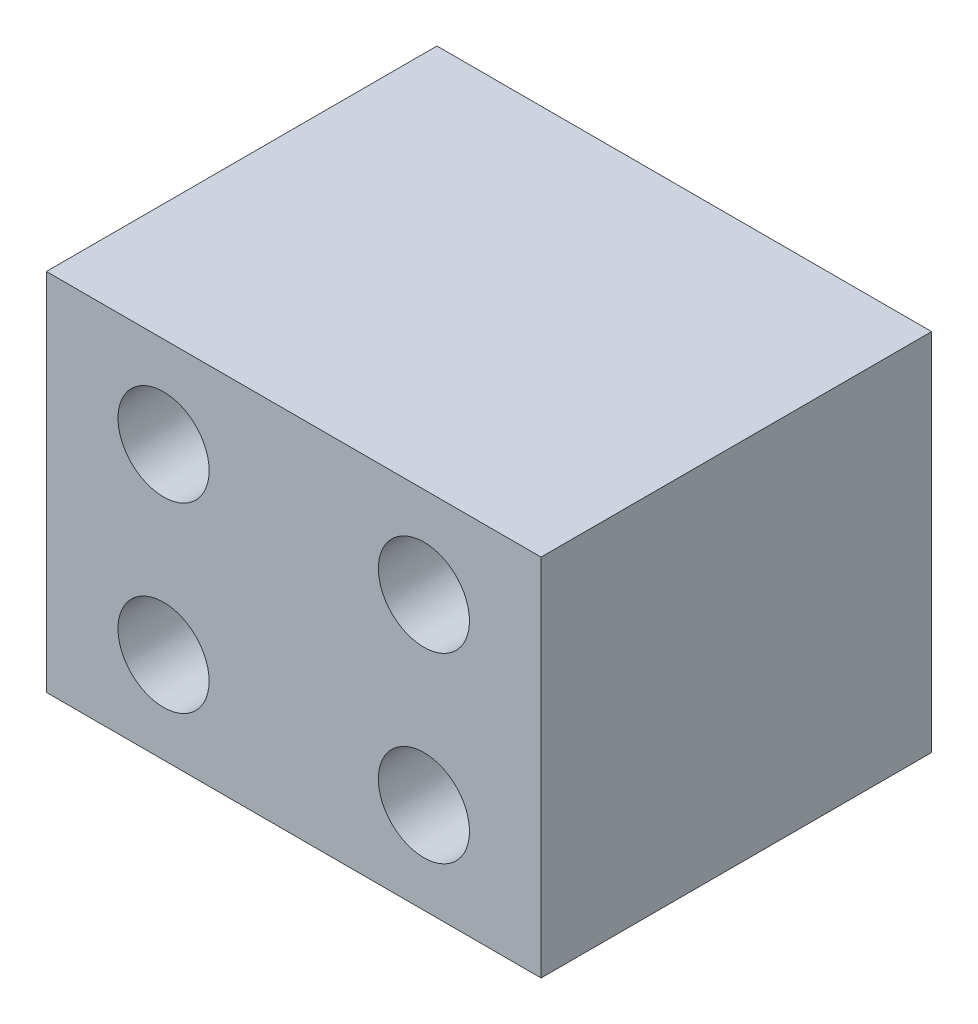
from build123d import *

# Parameters (mm, degrees)
SKETCH_1_W      = 19
SKETCH_1_H      = 14
SKETCH_1_R      = 1.75
EXTRUDE_1_DEPTH = 15


with BuildPart() as part:
    # 草图1 → 凸台-拉伸1 (new body)
    with BuildSketch(Plane.XY):
        Rectangle(SKETCH_1_W, SKETCH_1_H)
        with Locations((-5, 3.5)):
            Circle(SKETCH_1_R, mode=Mode.SUBTRACT)
        with Locations((5, 3.5)):
            Circle(SKETCH_1_R, mode=Mode.SUBTRACT)
        with Locations((5, -3.5)):
            Circle(SKETCH_1_R, mode=Mode.SUBTRACT)
        with Locations((-5, -3.5)):
            Circle(SKETCH_1_R, mode=Mode.SUBTRACT)
    extrude(amount=EXTRUDE_1_DEPTH)


solid = part.part
